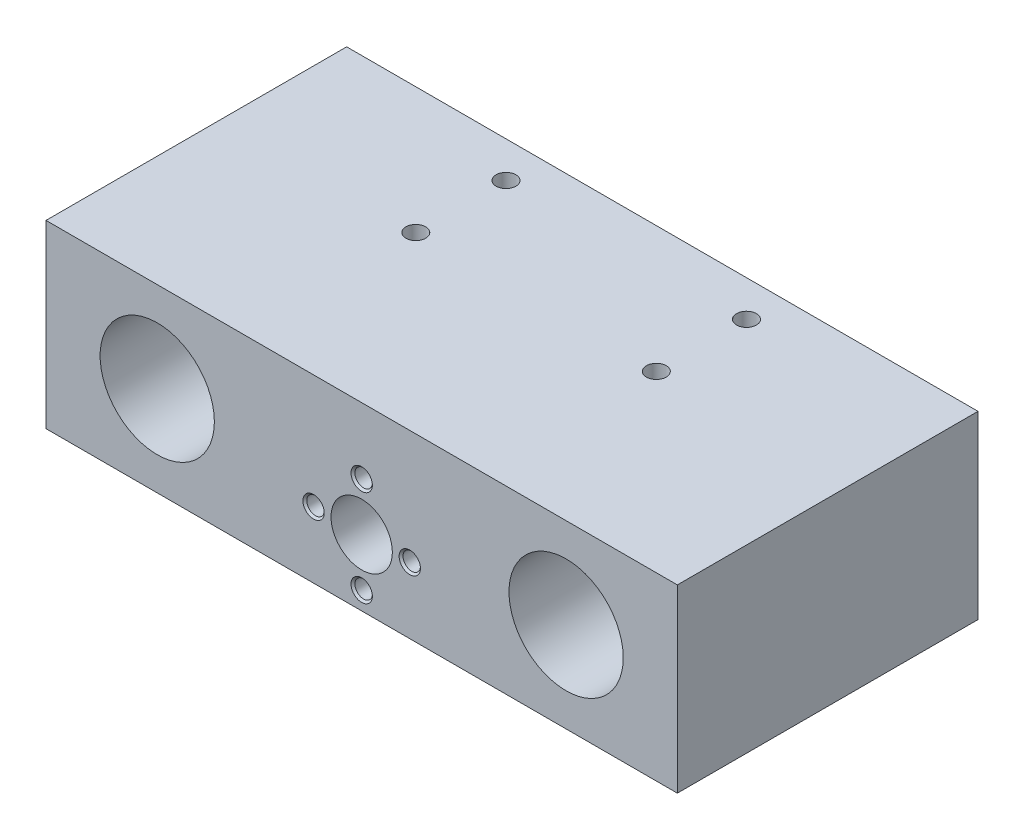
from build123d import *

# Parameters (mm, degrees)
ESBO_O1_W                             = 105
ESBO_O1_H                             = 30
ESBO_O1_R                             = 9.5
ESBO_O1_R_2                           = 4.25
RESSALTO_EXTRUS_O1_DEPTH              = 25
M4X0_7_TAPPED_HOLE1_D                 = 3.3
M4X0_7_TAPPED_HOLE1_DEPTH             = 11.5
M4X0_7_TAPPED_HOLE1_TIP               = 0.991420021
ESBO_O4_R                             = 5.1
CORTE_EXTRUS_O1_DEPTH                 = 11
FURO_ROSCADO_DE_M3_5X0_62_D           = 2.9
FURO_ROSCADO_DE_M3_5X0_62_DEPTH       = 15
FURO_ROSCADO_DE_M3_5X0_62_CSINK_D     = 3.55
FURO_ROSCADO_DE_M3_5X0_62_CSINK_ANGLE = 90
FURO_ROSCADO_DE_M3_5X0_62_TIP         = 0.871247898


with BuildPart() as part:
    # Esboço1 → Ressalto-extrusão1 (new, symmetric)
    with BuildSketch(Plane.XY):
        Rectangle(ESBO_O1_W, ESBO_O1_H)
        with Locations((-34, 0)):
            Circle(ESBO_O1_R, mode=Mode.SUBTRACT)
        with Locations((34, 0)):
            Circle(ESBO_O1_R, mode=Mode.SUBTRACT)
        with Locations((0, -4)):
            Circle(ESBO_O1_R_2, mode=Mode.SUBTRACT)
    extrude(amount=RESSALTO_EXTRUS_O1_DEPTH, both=True)

    # M4x0.7 Tapped Hole1
    with Locations(Plane(origin=(0, 15, 0), x_dir=(1, 0, 0), z_dir=(0, 1, 0))):
        with Locations((20, 19), (20, 4), (-20, 4), (-20, 19)):
            Hole(M4X0_7_TAPPED_HOLE1_D / 2, depth=M4X0_7_TAPPED_HOLE1_DEPTH)
            with Locations((0, 0, -(M4X0_7_TAPPED_HOLE1_DEPTH + M4X0_7_TAPPED_HOLE1_TIP / 2))):  # 118° drill point
                Cone(0, M4X0_7_TAPPED_HOLE1_D / 2, M4X0_7_TAPPED_HOLE1_TIP, mode=Mode.SUBTRACT)

    # Esboço4 → Corte-extrusão1 (cut)
    with BuildSketch(Plane.XY.offset(25)):
        with Locations((0, -4)):
            Circle(ESBO_O4_R)
    extrude(amount=-CORTE_EXTRUS_O1_DEPTH, mode=Mode.SUBTRACT)

    # Furo roscado de M3.5x0.62
    with Locations(Plane.XY.offset(25)):
        with Locations((-8, -4), (0, 4), (8, -4), (0, -12)):
            CounterSinkHole(FURO_ROSCADO_DE_M3_5X0_62_D / 2, FURO_ROSCADO_DE_M3_5X0_62_CSINK_D / 2, depth=FURO_ROSCADO_DE_M3_5X0_62_DEPTH, counter_sink_angle=FURO_ROSCADO_DE_M3_5X0_62_CSINK_ANGLE)
            with Locations((0, 0, -(FURO_ROSCADO_DE_M3_5X0_62_DEPTH + FURO_ROSCADO_DE_M3_5X0_62_TIP / 2))):  # 118° drill point
                Cone(0, FURO_ROSCADO_DE_M3_5X0_62_D / 2, FURO_ROSCADO_DE_M3_5X0_62_TIP, mode=Mode.SUBTRACT)


solid = part.part
